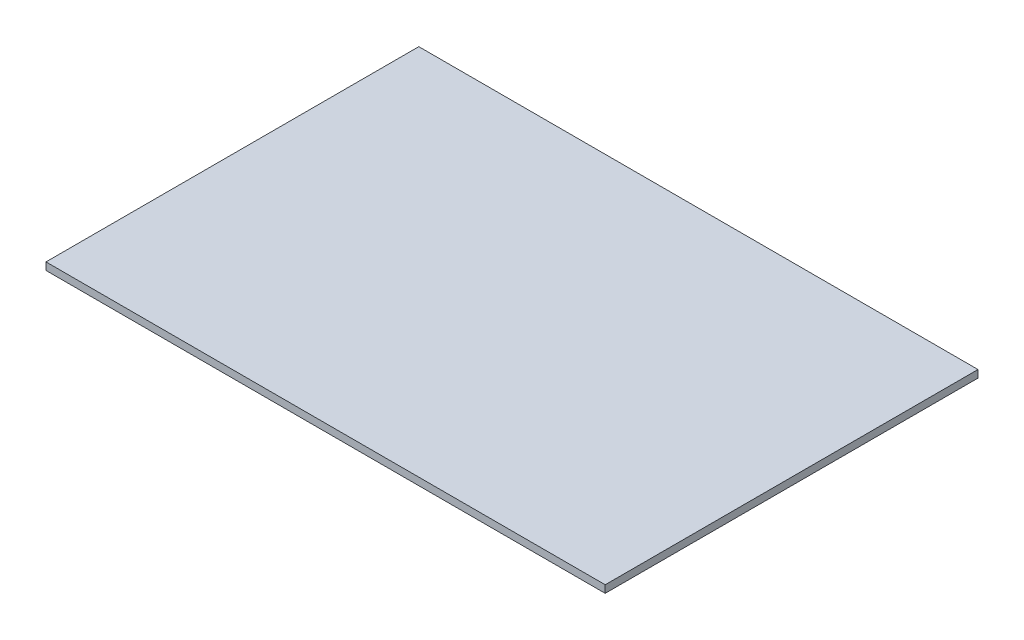
from build123d import *

# Parameters (mm, degrees)
SKETCH1_W           = 75
SKETCH1_H           = 50
BOSS_EXTRUDE1_DEPTH = 1


with BuildPart() as part:
    # Sketch1 → Boss-Extrude1 (new body)
    with BuildSketch(Plane(origin=(0, 0, 0), x_dir=(1, 0, 0), z_dir=(0, 1, 0))):
        with Locations((37.5, 25)):
            Rectangle(SKETCH1_W, SKETCH1_H)
    extrude(amount=BOSS_EXTRUDE1_DEPTH)


solid = part.part
